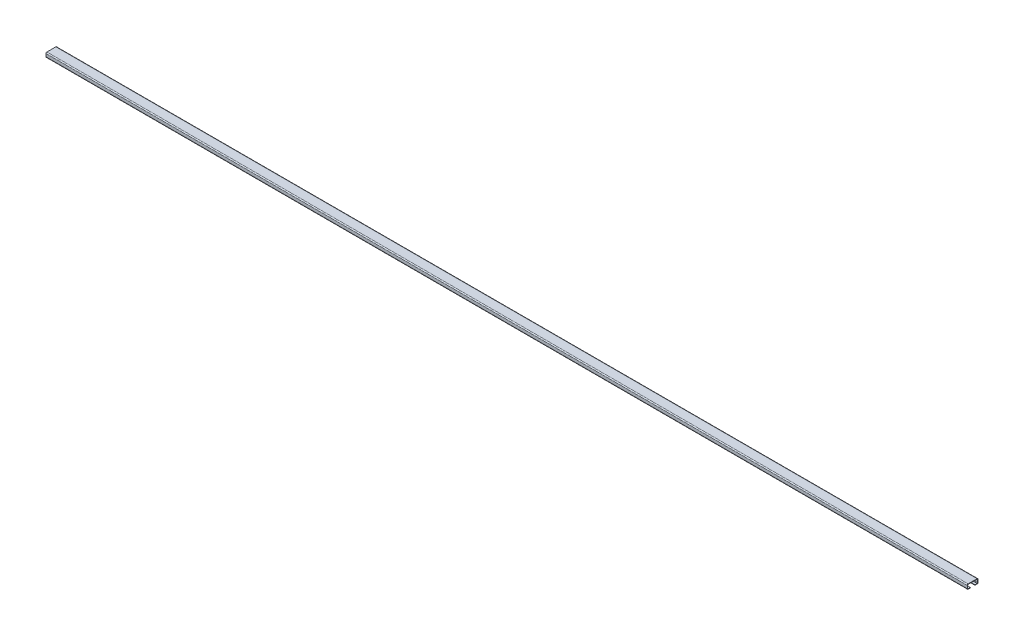
from build123d import *

# Parameters (mm, degrees)
CANAL_C_3_X_5_1_DEPTH = 6000


with BuildPart() as part:
    # Sketch110 → Canal c 3 X 5(1) (new body)
    with BuildSketch(Plane(origin=(3000, 0, 0), x_dir=(0, -1, 0), z_dir=(-1, 0, 0))):
        with BuildLine():
            Line((0, -28.8), (0, 28.8))
            ThreePointArc((0, 28.8), (1.815937957, 33.184062043), (6.2, 35))
            Line((6.2, 35), (23.8, 35))
            ThreePointArc((23.8, 35), (28.184062043, 33.184062043), (30, 28.8))
            Line((30, 28.8), (30, 15))
            Line((30, 15), (27.25, 15))
            Line((27.25, 15), (27.25, 29.25))
            ThreePointArc((27.25, 29.25), (26.371320344, 31.371320344), (24.25, 32.25))
            Line((24.25, 32.25), (5.75, 32.25))
            ThreePointArc((5.75, 32.25), (3.628679656, 31.371320344), (2.75, 29.25))
            Line((2.75, 29.25), (2.75, -29.25))
            ThreePointArc((2.75, -29.25), (3.628679656, -31.371320344), (5.75, -32.25))
            Line((5.75, -32.25), (24.25, -32.25))
            ThreePointArc((24.25, -32.25), (26.371320344, -31.371320344), (27.25, -29.25))
            Line((27.25, -29.25), (27.25, -15))
            Line((27.25, -15), (30, -15))
            Line((30, -15), (30, -28.8))
            ThreePointArc((30, -28.8), (28.184062043, -33.184062043), (23.8, -35))
            Line((23.8, -35), (6.2, -35))
            ThreePointArc((6.2, -35), (1.815937957, -33.184062043), (0, -28.8))
        make_face()
    extrude(amount=CANAL_C_3_X_5_1_DEPTH)


solid = part.part
